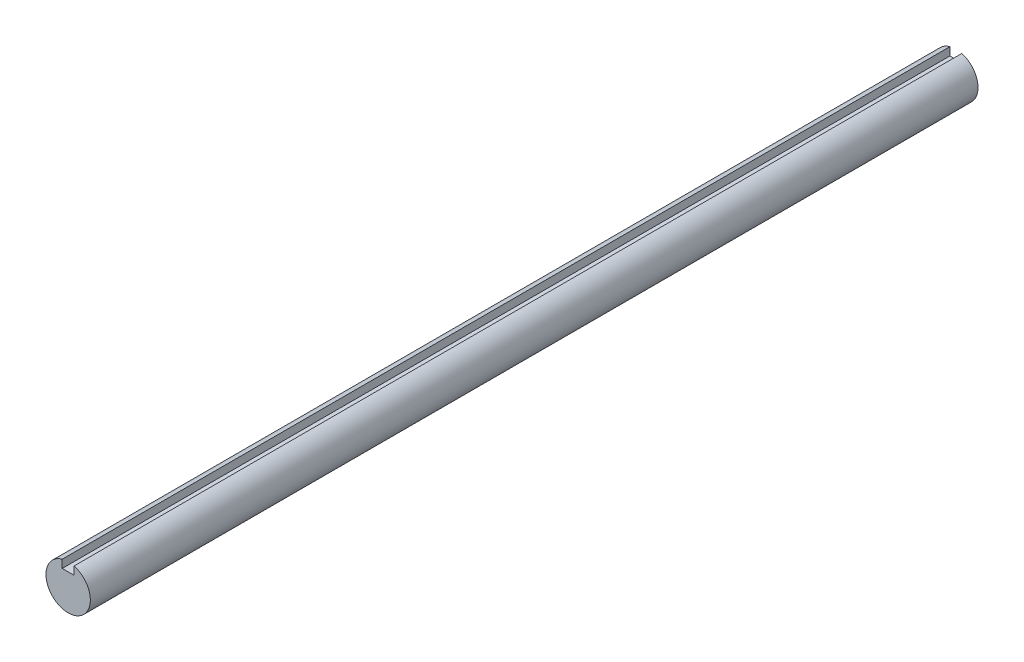
from build123d import *

# Parameters (mm, degrees)
SKETCH1_R           = 0.75
BOSS_EXTRUDE1_DEPTH = 30
SKETCH3_W           = 0.2
SKETCH3_H           = 0.357534677
CUT_EXTRUDE1_DEPTH  = 31.018744144


with BuildPart() as part:
    # Sketch1 → Boss-Extrude1 (new body)
    with BuildSketch(Plane.XY):
        Circle(SKETCH1_R)
    extrude(amount=BOSS_EXTRUDE1_DEPTH)

    # Sketch3 → Cut-Extrude1 (cut, through all)
    with BuildSketch(Plane.XY.offset(30)):
        with Locations((0.1, 0.628767338)):
            Rectangle(SKETCH3_W, SKETCH3_H)
    cut_extrude1 = extrude(amount=-CUT_EXTRUDE1_DEPTH, mode=Mode.SUBTRACT)

    # Mirror1: Cut-Extrude1 across plane
    add(cut_extrude1.mirror(Plane(origin=(0, 0, 0), x_dir=(0, 0, 1), z_dir=(1, 0, 0))), mode=Mode.SUBTRACT)


solid = part.part
